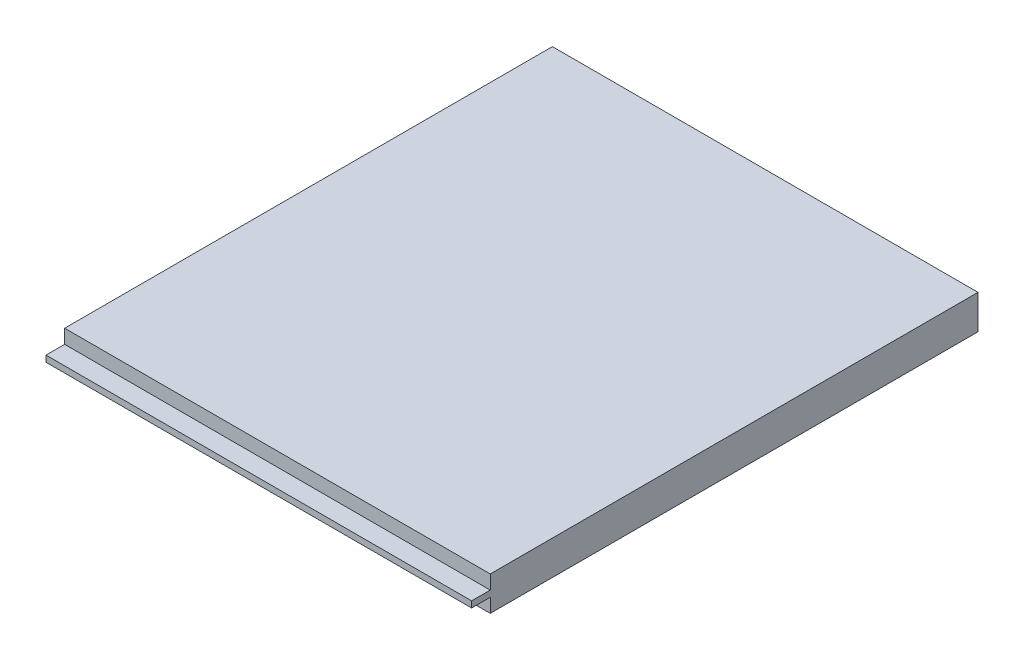
from build123d import *

# Parameters (mm, degrees)
SKETCH1_W           = 68.5
SKETCH1_H           = 5.5
BOSS_EXTRUDE1_DEPTH = 40.75
SKETCH2_W           = 68.5
SKETCH2_H           = 2.25
CUT_EXTRUDE1_DEPTH  = 3


with BuildPart() as part:
    # Sketch1 → Boss-Extrude1 (new, symmetric)
    with BuildSketch(Plane.XY):
        Rectangle(SKETCH1_W, SKETCH1_H)
    extrude(amount=BOSS_EXTRUDE1_DEPTH, both=True)

    # Sketch2 → Cut-Extrude1 (cut)
    with BuildSketch(Plane.XY.offset(40.75)):
        with Locations((0, 1.625)):
            Rectangle(SKETCH2_W, SKETCH2_H)
        with Locations((0, -1.625)):
            Rectangle(SKETCH2_W, SKETCH2_H)
    extrude(amount=-CUT_EXTRUDE1_DEPTH, mode=Mode.SUBTRACT)


solid = part.part
